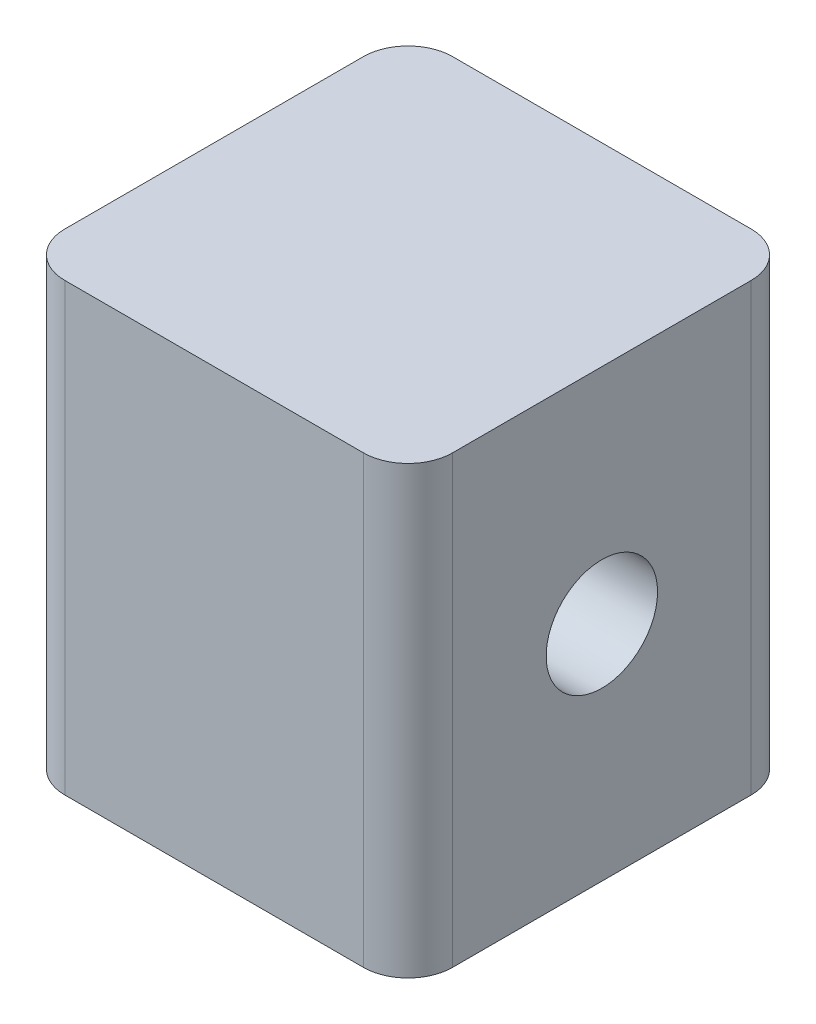
from build123d import *

# Parameters (mm, degrees)
SKETCH4_W           = 22.098
SKETCH4_H           = 22.098
BOSS_EXTRUDE2_DEPTH = 12.7
FILLET1_R           = 2.54
SKETCH6_R           = 3.175
CUT_EXTRUDE1_DEPTH  = 28.779344935


with BuildPart() as part:
    # Sketch4 → Boss-Extrude2 (new, symmetric)
    with BuildSketch(Plane(origin=(0, 0, 0), x_dir=(1, 0, 0), z_dir=(0, 1, 0))):
        Rectangle(SKETCH4_W, SKETCH4_H)
    extrude(amount=BOSS_EXTRUDE2_DEPTH, both=True)

    # Fillet1
    fillet1_edges = [part.edges().sort_by_distance(p)[0] for p in [
        (11.049, 0, 11.049),
        (-11.049, 0, 11.049),
        (-11.049, 0, -11.049),
        (11.049, 0, -11.049),
    ]]
    fillet(fillet1_edges, radius=FILLET1_R)

    # Sketch6 → Cut-Extrude1 (cut, through all)
    with BuildSketch(Plane(origin=(11.049, 0, 0), x_dir=(0, 0, -1), z_dir=(1, 0, 0))):
        Circle(SKETCH6_R)
    extrude(amount=-CUT_EXTRUDE1_DEPTH, mode=Mode.SUBTRACT)


solid = part.part
